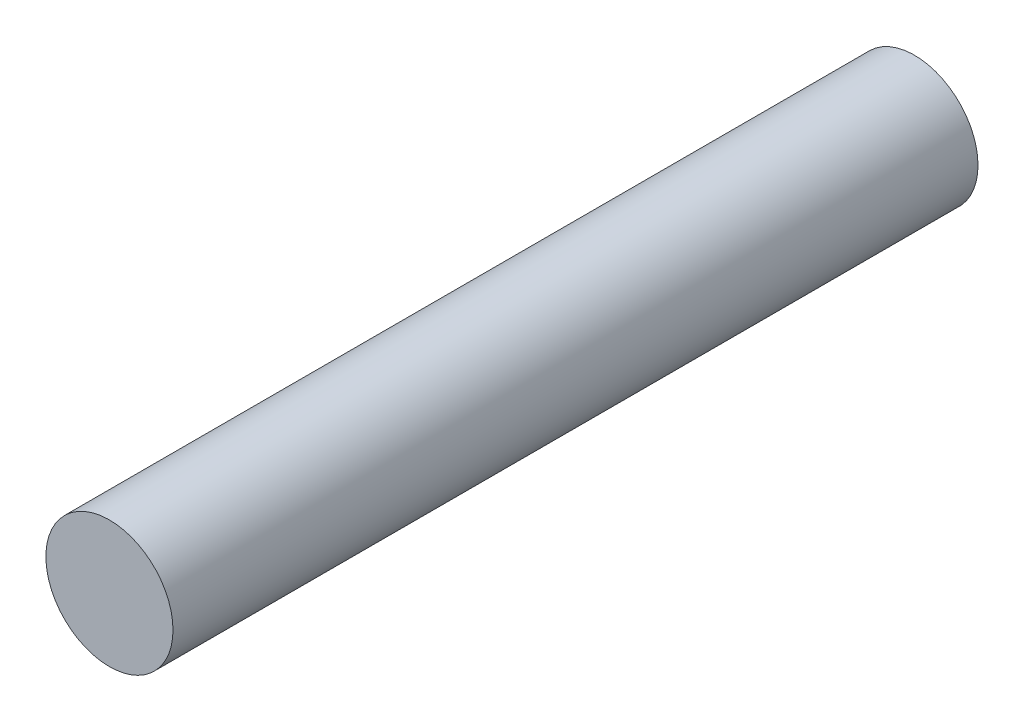
from build123d import *

# Parameters (mm, degrees)
SKETCH1_R           = 2.38125
BOSS_EXTRUDE1_DEPTH = 15.08125


with BuildPart() as part:
    # Sketch1 → Boss-Extrude1 (new, symmetric)
    with BuildSketch(Plane.XY):
        Circle(SKETCH1_R)
    extrude(amount=BOSS_EXTRUDE1_DEPTH, both=True)


solid = part.part
